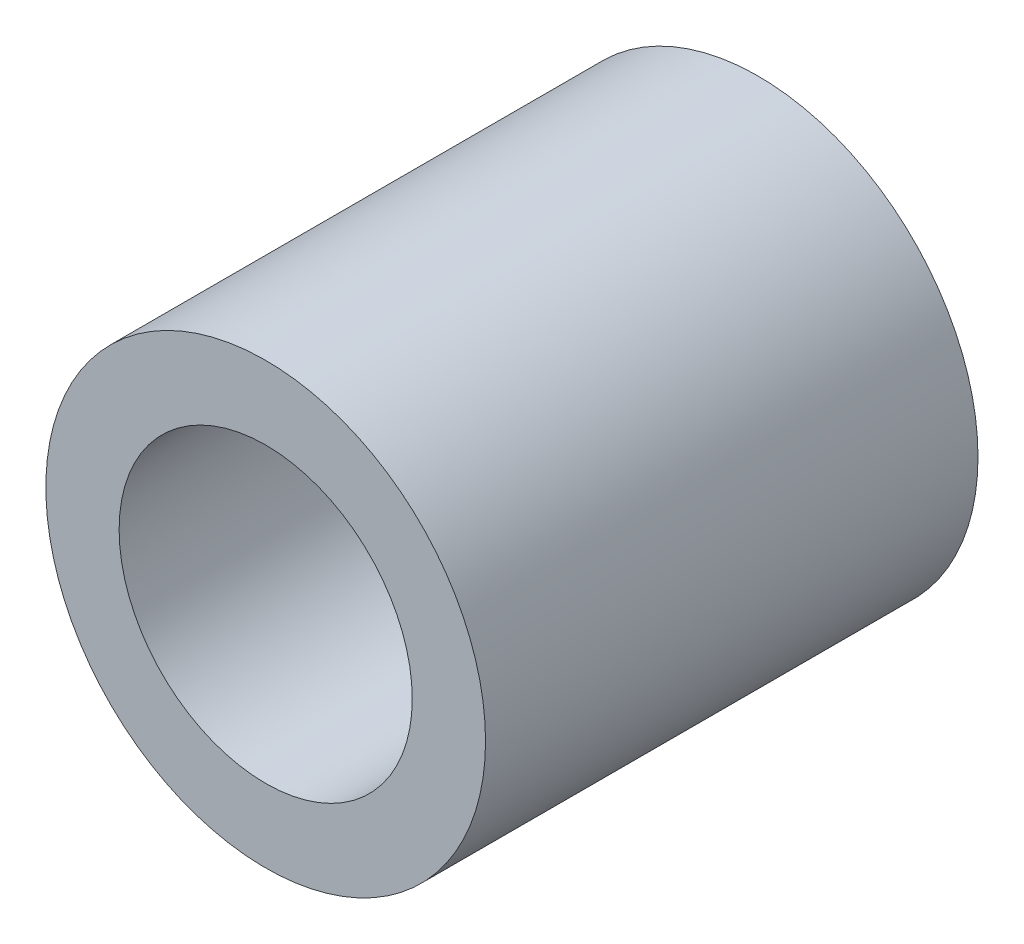
from build123d import *

# Parameters (mm, degrees)
SKETCH1_R           = 9.525
SKETCH1_R_2         = 6.35
BOSS_EXTRUDE1_DEPTH = 10.668


with BuildPart() as part:
    # Sketch1 → Boss-Extrude1 (new, symmetric)
    with BuildSketch(Plane.XY):
        Circle(SKETCH1_R)
        Circle(SKETCH1_R_2, mode=Mode.SUBTRACT)
    extrude(amount=BOSS_EXTRUDE1_DEPTH, both=True)


solid = part.part
